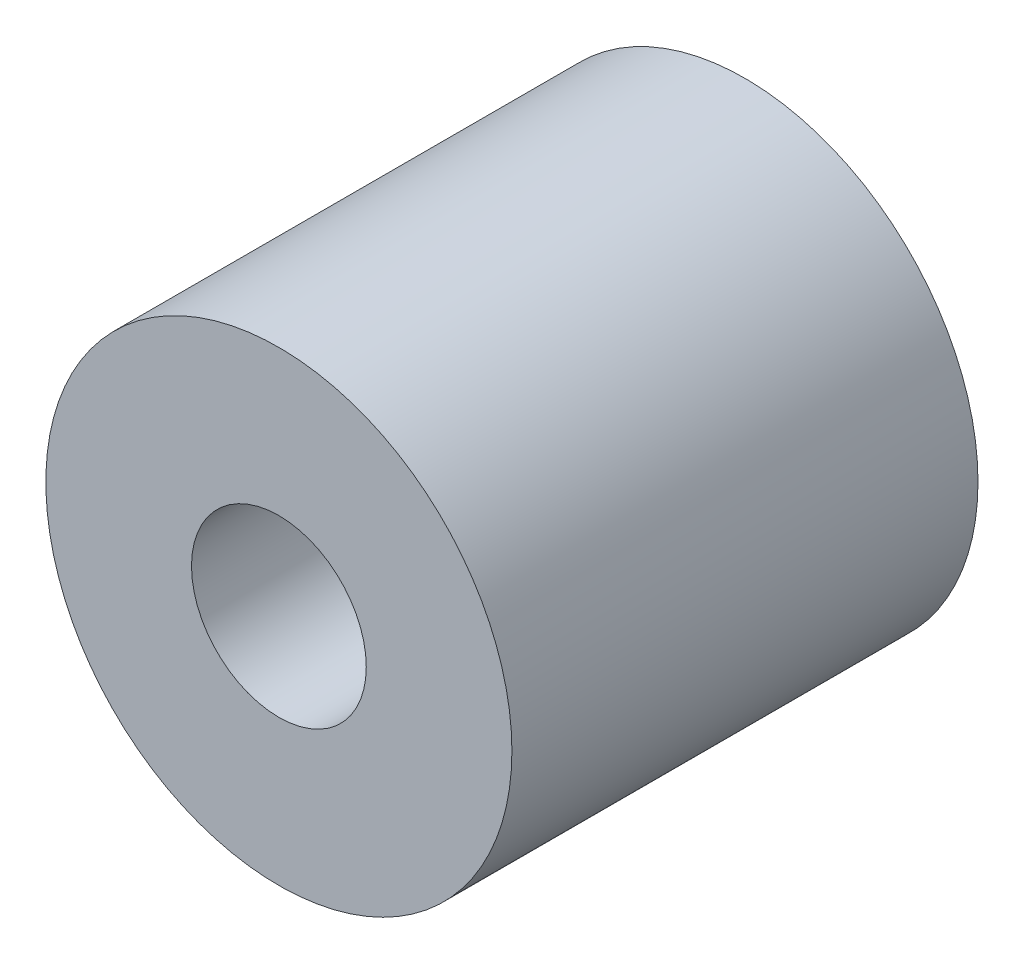
from build123d import *

# Parameters (mm, degrees)
SKETCH1_R           = 4
SKETCH1_R_2         = 1.5
BOSS_EXTRUDE1_DEPTH = 8


with BuildPart() as part:
    # Sketch1 → Boss-Extrude1 (new body)
    with BuildSketch(Plane.XY):
        Circle(SKETCH1_R)
        Circle(SKETCH1_R_2, mode=Mode.SUBTRACT)
    extrude(amount=BOSS_EXTRUDE1_DEPTH)


solid = part.part
